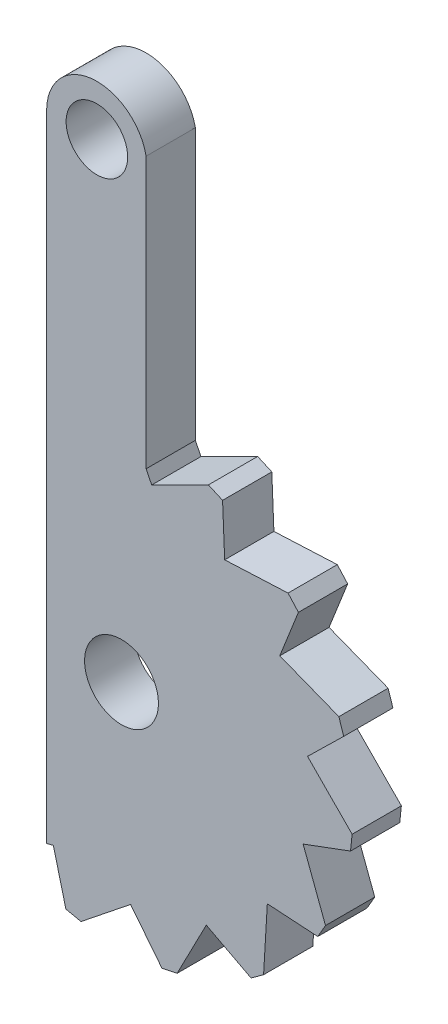
from build123d import *

# Parameters (mm, degrees)
SKETCH1_R           = 1.25
BOSS_EXTRUDE2_DEPTH = 2


with BuildPart() as part:
    # Sketch1 → Boss-Extrude2 (new body)
    with BuildSketch(Plane.XY):
        with BuildLine():
            Line((8.285184221, -4.420298479), (7.377074087, -2.008607594))
            Line((7.377074087, -2.008607594), (9.301041093, -1.293812508))
            Line((9.301041093, -1.293812508), (9.366789776, -0.66825558))
            Line((9.366789776, -0.66825558), (7.556266833, 1.165572006))
            Line((7.556266833, 1.165572006), (9.023164798, 2.601117692))
            Line((9.023164798, 2.601117692), (8.828792284, 3.199334781))
            Line((8.828792284, 3.199334781), (6.428912397, 4.138213618))
            Line((6.428912397, 4.138213618), (7.185101337, 6.046291012))
            Line((7.185101337, 6.046291012), (6.764216399, 6.513731092))
            Line((6.764216399, 6.513731092), (4.189940603, 6.3953205))
            Line((4.189940603, 6.3953205), (4.10466858, 8.446005688))
            Line((4.10466858, 8.446005688), (3.530046047, 8.701844123))
            Line((3.530046047, 8.701844123), (1.226490014, 7.546618369))
            Line((1.226490014, 7.546618369), (1, 8.003257429))
            Line((1, 8.003257429), (1, 19))
            ThreePointArc((1, 19), (-1.19198009, 20.624419756), (-3.040958638, 18.618230684))
            Line((-3.040958638, 18.618230684), (-3.040958638, -7.197788875))
            Line((-3.040958638, -7.197788875), (-2.76871845, -7.126705038))
            Line((-2.76871845, -7.126705038), (-2.2589484, -9.114848784))
            Line((-2.2589484, -9.114848784), (-1.643690947, -9.245625793))
            Line((-1.643690947, -9.245625793), (0.36934192, -7.636708264))
            Line((0.36934192, -7.636708264), (1.643690947, -9.245625793))
            Line((1.643690947, -9.245625793), (2.2589484, -9.114848784))
            Line((2.2589484, -9.114848784), (3.443539717, -6.826255253))
            Line((3.443539717, -6.826255253), (5.262121196, -7.777750108))
            Line((5.262121196, -7.777750108), (5.770995046, -7.408031615))
            Line((5.770995046, -7.408031615), (5.922318213, -4.835480694))
            Line((5.922318213, -4.835480694), (7.970682886, -4.965030771))
            Line((7.970682886, -4.965030771), (8.285184221, -4.420298479))
        make_face()
        with BuildLine():
            ThreePointArc((0.384303163, 1.449934853), (0.711767769, 1.320373675), (1, 1.118033989))
            ThreePointArc((1, 1.118033989), (-0.706323533, -1.323294021), (0.372346585, 1.45305128))
            Line((0.372346585, 1.45305128), (0.384303163, 1.449934853))
        make_face(mode=Mode.SUBTRACT)
        with Locations((-1, 18.592345483)):
            Circle(SKETCH1_R, mode=Mode.SUBTRACT)
    extrude(amount=BOSS_EXTRUDE2_DEPTH)


solid = part.part
